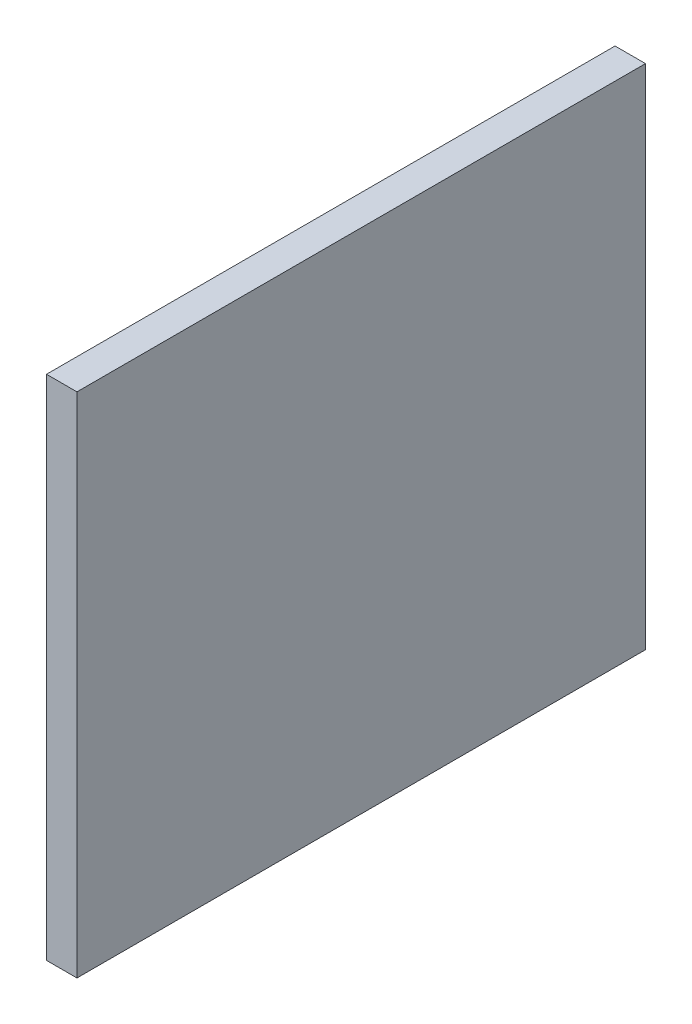
from build123d import *

# Parameters (mm, degrees)
SKETCH1_W           = 56
SKETCH1_H           = 50
BOSS_EXTRUDE1_DEPTH = 3


with BuildPart() as part:
    # Sketch1 → Boss-Extrude1 (new body)
    with BuildSketch(Plane(origin=(0, 0, 0), x_dir=(0, 0, -1), z_dir=(1, 0, 0))):
        Rectangle(SKETCH1_W, SKETCH1_H)
    extrude(amount=BOSS_EXTRUDE1_DEPTH)


solid = part.part
